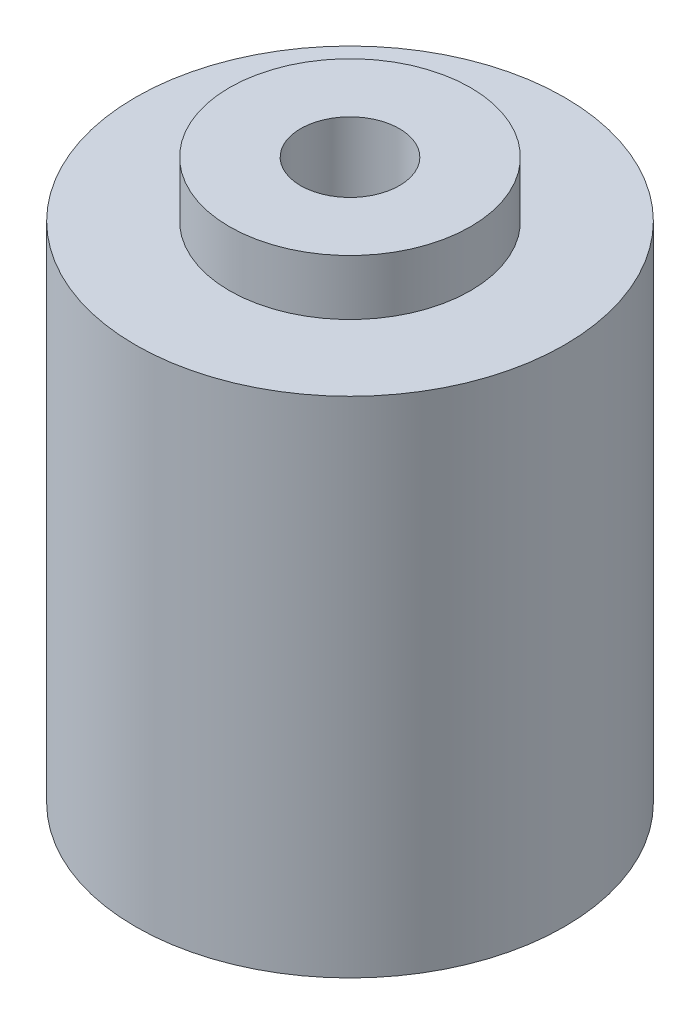
from build123d import *

# Parameters (mm, degrees)
CROQUIS1_R              = 22.606
SALIENTE_EXTRUIR1_DEPTH = 50.8
CROQUIS2_R              = 12.7
SALIENTE_EXTRUIR2_DEPTH = 56.642
CROQUIS3_R              = 2.54
CORTAR_EXTRUIR1_DEPTH   = 31.242
CROQUIS4_R              = 5.207
CORTAR_EXTRUIR4_DEPTH   = 144.018
SALIENTE_EXTRUIR3_START = -2.286
CROQUIS5_R              = 22.606
SALIENTE_EXTRUIR3_DEPTH = 2.286
C_PULA1_FACE_RADIUS     = 22.606
C_PULA1_HEIGHT          = 2.54


with BuildPart() as part:
    # Croquis1 → Saliente-Extruir1 (new body)
    with BuildSketch(Plane(origin=(0, 0, 0), x_dir=(1, 0, 0), z_dir=(0, 1, 0))):
        with Locations(Location((0, 0, 0), (0, 0, 270))):
            Circle(CROQUIS1_R)
    extrude(amount=SALIENTE_EXTRUIR1_DEPTH)

    # Croquis2 → Saliente-Extruir2 (add)
    with BuildSketch(Plane(origin=(0, 0, 0), x_dir=(1, 0, 0), z_dir=(0, 1, 0))):
        with Locations(Location((0, 0, 0), (0, 0, 270))):
            Circle(CROQUIS2_R)
    extrude(amount=SALIENTE_EXTRUIR2_DEPTH)

    # Croquis3 → Cortar-Extruir1 (cut)
    with BuildSketch(Plane(origin=(0, 0, 0), x_dir=(0, 0, -1), z_dir=(1, 0, 0))):
        with Locations((0, 40.032848535)):
            Circle(CROQUIS3_R)
        with Locations((0, 15.428124721)):
            Circle(CROQUIS3_R)
    extrude(amount=-CORTAR_EXTRUIR1_DEPTH, mode=Mode.SUBTRACT)

    # Croquis4 → Cortar-Extruir4 (cut)
    with BuildSketch(Plane(origin=(0, 0, 0), x_dir=(1, 0, 0), z_dir=(0, 1, 0))):
        with Locations(Location((0, 0, 0), (0, 0, 270))):
            Circle(CROQUIS4_R)
    extrude(amount=CORTAR_EXTRUIR4_DEPTH, mode=Mode.SUBTRACT)

    # Croquis5 → Saliente-Extruir3 (add)
    with BuildSketch(Plane(origin=(0, 0, 0), x_dir=(1, 0, 0), z_dir=(0, 1, 0)).offset(SALIENTE_EXTRUIR3_START)):
        with Locations(Location((0, 0, 0), (0, 0, 270))):
            Circle(CROQUIS5_R)
    extrude(amount=SALIENTE_EXTRUIR3_DEPTH)

    # Cúpula1: a dome of height H over a round flat face of radius A is a cap of a sphere of radius (A * A + H * H) / (2 * H)
    c_pula1_r = (C_PULA1_FACE_RADIUS * C_PULA1_FACE_RADIUS + C_PULA1_HEIGHT * C_PULA1_HEIGHT) / (2 * C_PULA1_HEIGHT)
    c_pula1_base = Plane((0, -2.286, 0), z_dir=(0, -1, 0))
    with Locations(c_pula1_base.offset(C_PULA1_HEIGHT - c_pula1_r)):
        c_pula1_ball = Sphere(c_pula1_r, mode=Mode.PRIVATE)
    add(split(c_pula1_ball, bisect_by=c_pula1_base, keep=Keep.TOP, mode=Mode.PRIVATE))


solid = part.part
